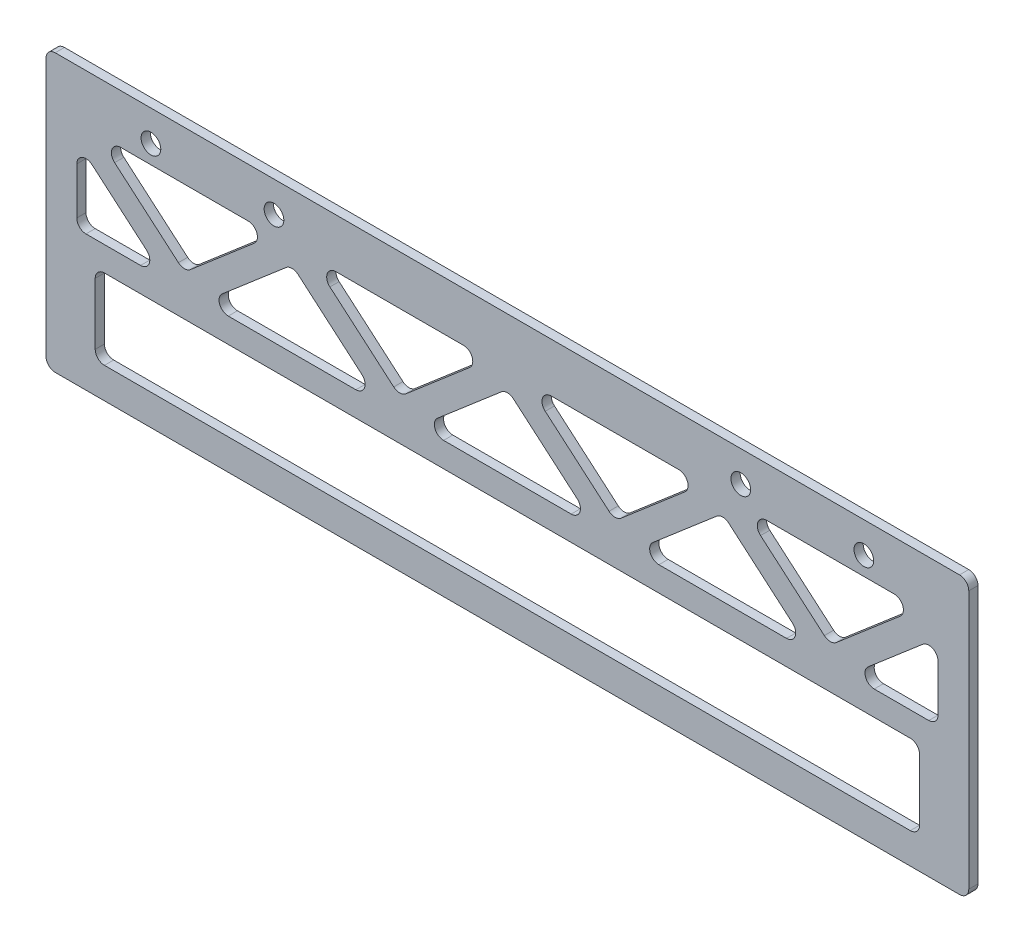
from build123d import *

# Parameters (mm, degrees)
SKETCH_1_W          = 150
SKETCH_1_H          = 45
EXTRUDE_1_DEPTH     = 1.5
SKETCH_2_R          = 1.6
SKETCH_2_W          = 134
SKETCH_2_H          = 13
CUT_EXTRUDE_1_DEPTH = 79.316664893
CUT_EXTRUDE_2_DEPTH = 79.316664893
FILLET_1_R          = 1.5


with BuildPart() as part:
    # 草图1 → 凸台-拉伸1 (new body)
    with BuildSketch(Plane.XY):
        Rectangle(SKETCH_1_W, SKETCH_1_H)
    extrude(amount=EXTRUDE_1_DEPTH)

    # 草图2 → 切除-拉伸1 (cut, through all)
    with BuildSketch(Plane.XY.offset(1.5)):
        with Locations((37.942286341, 17.5)):
            Circle(SKETCH_2_R)
        with Locations((57.942286341, 17.5)):
            Circle(SKETCH_2_R)
        with Locations((-37.942286341, 17.5)):
            Circle(SKETCH_2_R)
        with Locations((-57.942286341, 17.5)):
            Circle(SKETCH_2_R)
        with Locations((0, -11)):
            Rectangle(SKETCH_2_W, SKETCH_2_H)
    extrude(amount=-CUT_EXTRUDE_1_DEPTH, mode=Mode.SUBTRACT)

    # 草图3 → 切除-拉伸2 (cut, through all)
    with BuildSketch(Plane.XY.offset(1.5)):
        Polygon((-55.573181486, -0.5), (-70, 11.865844441), (-70, -0.5), align=None)
        Polygon((-38.073181486, 14.5), (-66.926818514, 14.5), (-52.5, 2.134155559), align=None)
        Polygon((-35, 11.865844441), (-49.426818514, -0.5), (-20.573181486, -0.5), align=None)
        Polygon((-3.073181486, 14.5), (-31.926818514, 14.5), (-17.5, 2.134155559), align=None)
        Polygon((0, 11.865844441), (-14.426818514, -0.5), (14.426818514, -0.5), align=None)
        Polygon((31.926818514, 14.5), (3.073181486, 14.5), (17.5, 2.134155559), align=None)
        Polygon((35, 11.865844441), (20.573181486, -0.5), (49.426818514, -0.5), align=None)
        Polygon((66.926818514, 14.5), (38.073181486, 14.5), (52.5, 2.134155559), align=None)
        Polygon((70, 11.865844441), (55.573181486, -0.5), (70, -0.5), align=None)
    extrude(amount=-CUT_EXTRUDE_2_DEPTH, mode=Mode.SUBTRACT)

    # 圆角1
    fillet_1_edges = [part.edges().sort_by_distance(p)[0] for p in [
        (17.5, 2.134155559, 0.75),
        (3.073181486, 14.5, 0.75),
        (31.926818514, 14.5, 0.75),
        (35, 11.865844441, 0.75),
        (49.426818514, -0.5, 0.75),
        (20.573181486, -0.5, 0.75),
        (-70, 11.865844441, 0.75),
        (-55.573181486, -0.5, 0.75),
        (-70, -0.5, 0.75),
        (67, -4.5, 0.75),
        (67, -17.5, 0.75),
        (-67, -17.5, 0.75),
        (-67, -4.5, 0.75),
        (-17.5, 2.134155559, 0.75),
        (-31.926818514, 14.5, 0.75),
        (-3.073181486, 14.5, 0.75),
        (75, -22.5, 0.75),
        (-75, -22.5, 0.75),
        (0, 11.865844441, 0.75),
        (14.426818514, -0.5, 0.75),
        (-75, 22.5, 0.75),
        (-14.426818514, -0.5, 0.75),
        (75, 22.5, 0.75),
        (-52.5, 2.134155559, 0.75),
        (-66.926818514, 14.5, 0.75),
        (-38.073181486, 14.5, 0.75),
        (-35, 11.865844441, 0.75),
        (-20.573181486, -0.5, 0.75),
        (-49.426818514, -0.5, 0.75),
        (52.5, 2.134155559, 0.75),
        (38.073181486, 14.5, 0.75),
        (66.926818514, 14.5, 0.75),
        (55.573181486, -0.5, 0.75),
        (70, 11.865844441, 0.75),
        (70, -0.5, 0.75),
    ]]
    fillet(fillet_1_edges, radius=FILLET_1_R)


solid = part.part
